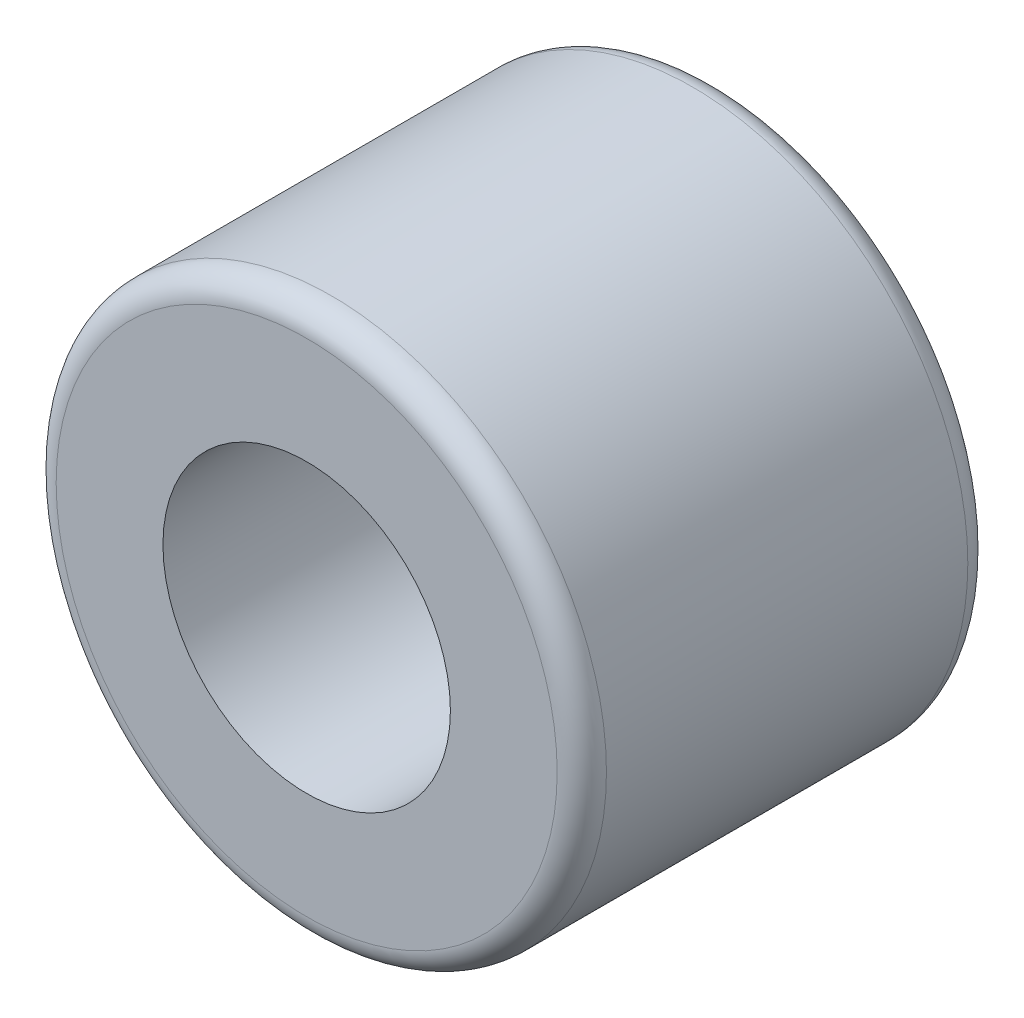
from build123d import *

# Parameters (mm, degrees)
SKETCH1_R           = 8.509
SKETCH1_R_2         = 4.445
BOSS_EXTRUDE1_DEPTH = 12.7
FILLET1_R           = 0.762


with BuildPart() as part:
    # Sketch1 → Boss-Extrude1 (new body)
    with BuildSketch(Plane.XY):
        Circle(SKETCH1_R)
        Circle(SKETCH1_R_2, mode=Mode.SUBTRACT)
    extrude(amount=BOSS_EXTRUDE1_DEPTH)

    # Fillet1
    fillet1_edges = [part.edges().sort_by_distance(p)[0] for p in [
        (-8.509, 0, 0),
        (-8.509, 0, 12.7),
    ]]
    fillet(fillet1_edges, radius=FILLET1_R)


solid = part.part
